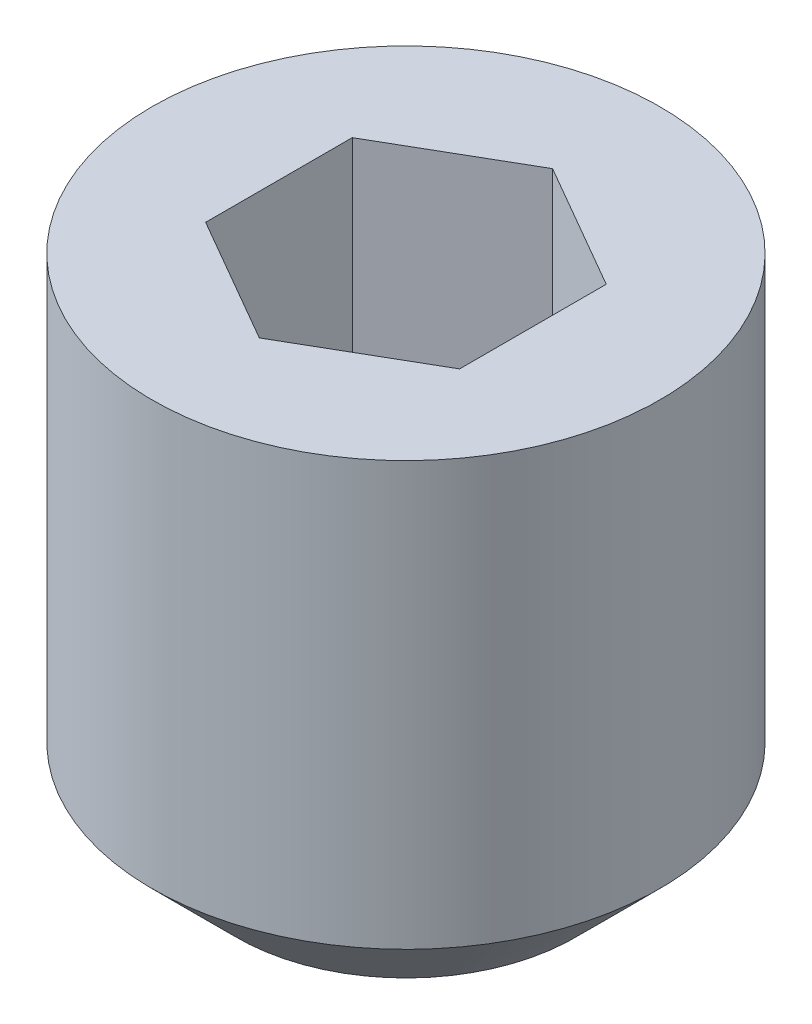
from build123d import *

# Parameters (mm, degrees)
SKETCH1_W          = 1.5
SKETCH1_H          = 3
CUT_EXTRUDE1_DEPTH = 1.2


with BuildPart() as part:
    # Sketch1 → Revolve1 (revolve)
    with BuildSketch(Plane.XY, mode=Mode.PRIVATE) as revolve1_sk:
        with Locations((0.75, 1.5)):
            Rectangle(SKETCH1_W, SKETCH1_H)
    revolve(revolve1_sk.sketch.rotate(Axis((0, 3, 0), (0, -1, 0)), 180), axis=Axis((0, 3, 0), (0, -1, 0)))

    # Sketch2 → Cut-Revolve1 (revolve, cut)
    with BuildSketch(Plane.XY, mode=Mode.PRIVATE) as cut_revolve1_sk:
        Polygon((0, 3), (0.75, 3), (0.75, 1.8), (0, 1.366987298), align=None)
    revolve(cut_revolve1_sk.sketch.rotate(Axis((0, 3, 0), (0, -1, 0)), 180), axis=Axis((0, 3, 0), (0, -1, 0)), mode=Mode.SUBTRACT)

    # Sketch3 → Cut-Extrude1 (cut)
    with BuildSketch(Plane(origin=(0, 3, 0), x_dir=(1, 0, 0), z_dir=(0, 1, 0))):
        Polygon((0, 0.866025404), (-0.75, 0.433012702), (-0.75, -0.433012702), (0, -0.866025404), (0.75, -0.433012702), (0.75, 0.433012702), align=None)
    extrude(amount=-CUT_EXTRUDE1_DEPTH, mode=Mode.SUBTRACT)

    # Sketch4 → Cut-Revolve2 (revolve, cut)
    with BuildSketch(Plane.XY, mode=Mode.PRIVATE) as cut_revolve2_sk:
        Polygon((1.5, 0.5), (1.5, 0), (1, 0), align=None)
    revolve(cut_revolve2_sk.sketch.rotate(Axis((0, 3, 0), (0, -1, 0)), 180), axis=Axis((0, 3, 0), (0, -1, 0)), mode=Mode.SUBTRACT)


solid = part.part
